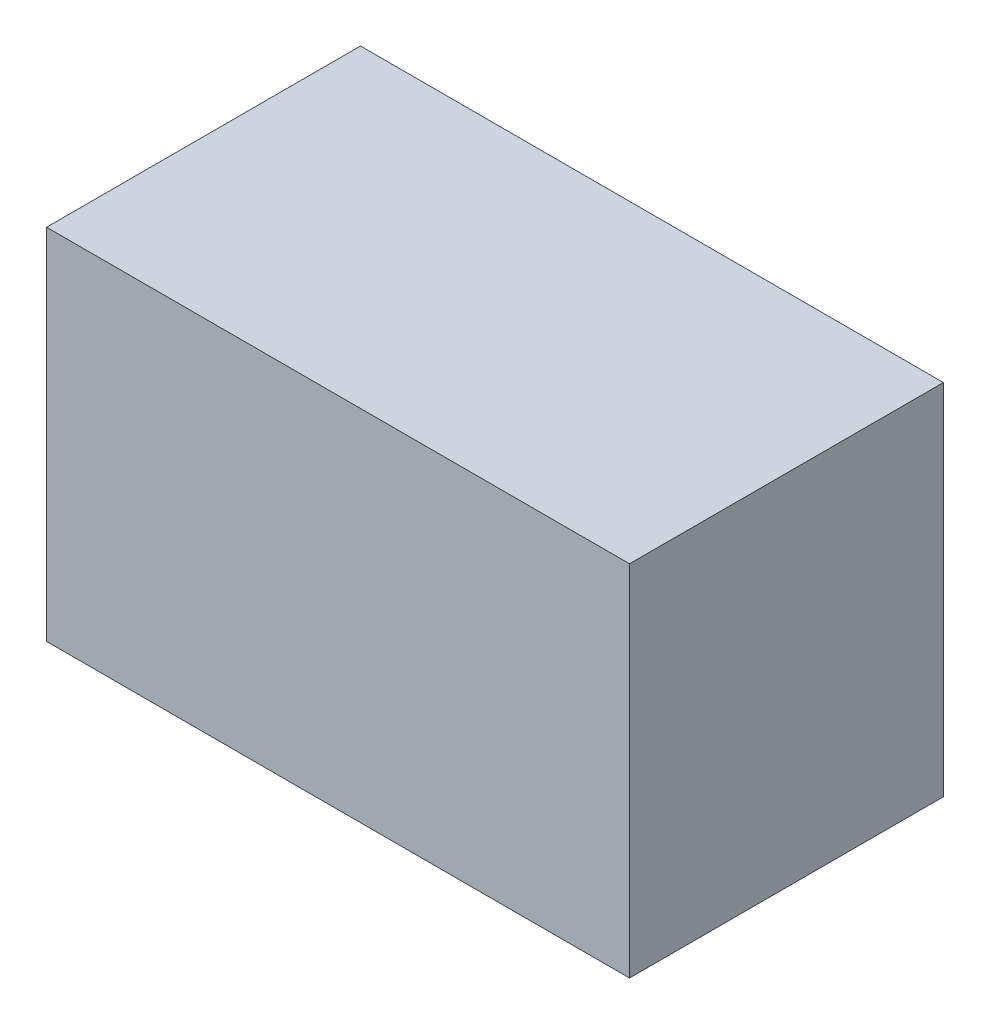
from build123d import *

# Parameters (mm, degrees)
SKETCH2_W           = 65
SKETCH2_H           = 40
BOSS_EXTRUDE1_DEPTH = 35


with BuildPart() as part:
    # Sketch2 → Boss-Extrude1 (new body)
    with BuildSketch(Plane.XY):
        with Locations((0, 57.10911804)):
            Rectangle(SKETCH2_W, SKETCH2_H)
    extrude(amount=BOSS_EXTRUDE1_DEPTH)


solid = part.part
